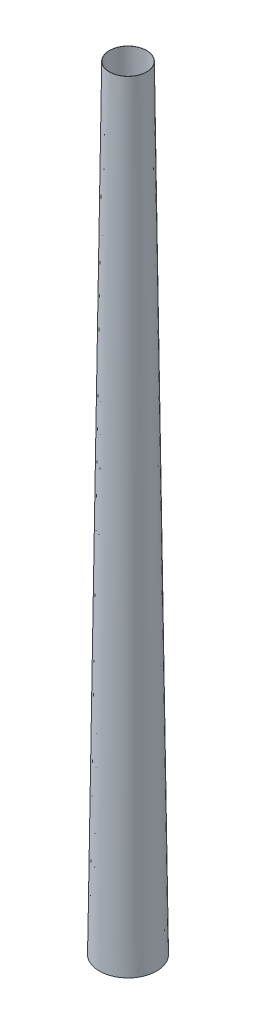
from build123d import *


with BuildPart() as part:
    # Sketch1 → Revolve1 (revolve)
    with BuildSketch(Plane.XY, mode=Mode.PRIVATE) as revolve1_sk:
        Polygon((4959, 0), (5000, 0), (3254, 135000), (3230, 135000), align=None)
    revolve(revolve1_sk.sketch.rotate(Axis((0, 0, 0), (0, 1, 0)), 90), axis=Axis((0, 0, 0), (0, 1, 0)))


solid = part.part
